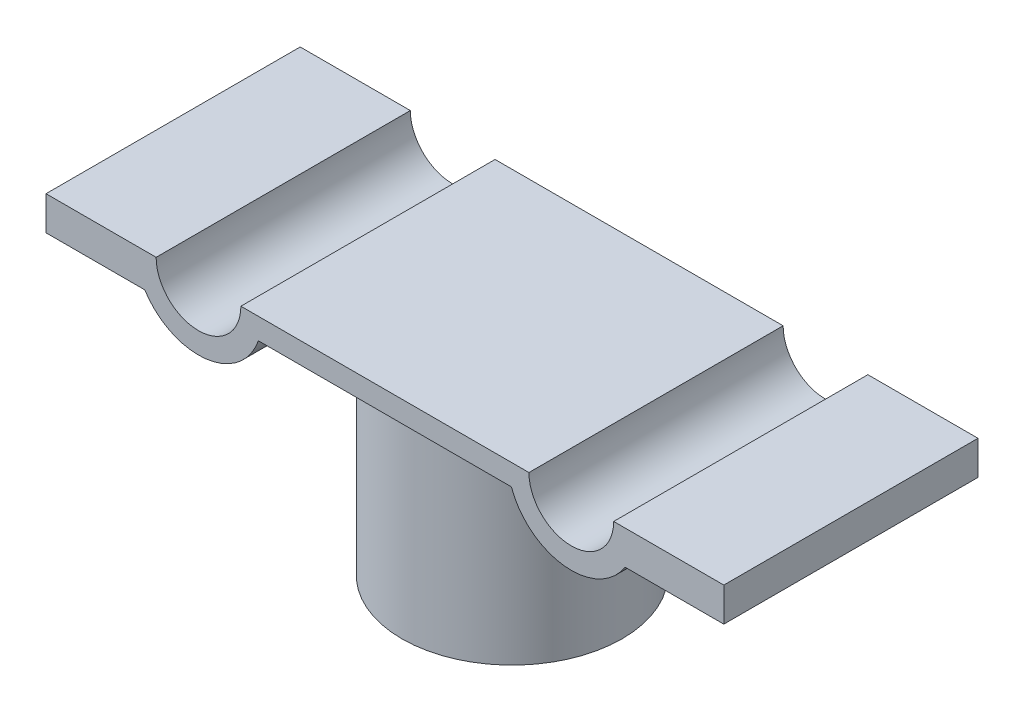
from build123d import *

# Parameters (mm, degrees)
SALIENTE_EXTRUIR1_DEPTH = 30
CROQUIS2_R              = 13
CROQUIS2_R_2            = 10.5
SALIENTE_EXTRUIR2_DEPTH = 20
CROQUIS6_W              = 26
CROQUIS6_H              = 15
CORTAR_EXTRUIR4_DEPTH   = 15
CROQUIS7_R              = 13
SALIENTE_EXTRUIR3_DEPTH = 4
CROQUIS9_R              = 8
CORTAR_EXTRUIR6_DEPTH   = 55.829280499
SALIENTE_EXTRUIR4_START = 4
SALIENTE_EXTRUIR4_DEPTH = 4
CROQUIS8_W              = 8
CROQUIS8_H              = 19
CORTAR_EXTRUIR5_DEPTH   = 20


with BuildPart() as part:
    # Croquis1 → Saliente-Extruir1 (new body)
    with BuildSketch(Plane.XY):
        with BuildLine():
            Line((-40, -1.5), (-40, 2.5))
            Line((-40, 2.5), (-28.34428877, 2.5))
            Line((-28.34428877, 2.5), (-27, 2.5))
            ThreePointArc((-27, 2.5), (-22, -2.5), (-17, 2.5))
            Line((-17, 2.5), (-5.669872981, 2.5))
            Line((-5.669872981, 2.5), (5.669872981, 2.5))
            Line((5.669872981, 2.5), (17, 2.5))
            ThreePointArc((17, 2.5), (22, -2.5), (27, 2.5))
            Line((27, 2.5), (28.34428877, 2.5))
            Line((28.34428877, 2.5), (40, 2.5))
            Line((40, 2.5), (40, -1.5))
            Line((40, -1.5), (28.34428877, -1.5))
            ThreePointArc((28.34428877, -1.5), (21.16660217, -4.953552714), (14.928932188, 0))
            Line((14.928932188, 0), (-14.928932188, 0))
            ThreePointArc((-14.928932188, 0), (-21.16660217, -4.953552714), (-28.34428877, -1.5))
            Line((-28.34428877, -1.5), (-40, -1.5))
        make_face()
    extrude(amount=SALIENTE_EXTRUIR1_DEPTH)

    # Croquis2 → Saliente-Extruir2 (add)
    with BuildSketch(Plane.XZ):
        with Locations(Location((0, 15, 0), (0, 0, 180))):
            Circle(CROQUIS2_R)
        with Locations((0, 15)):
            Circle(CROQUIS2_R_2, mode=Mode.SUBTRACT)
    extrude(amount=SALIENTE_EXTRUIR2_DEPTH)

    # Croquis6 → Cortar-Extruir4 (cut)
    with BuildSketch(Plane.XY):
        with Locations((0, -12.5)):
            Rectangle(CROQUIS6_W, CROQUIS6_H)
    extrude(amount=CORTAR_EXTRUIR4_DEPTH, mode=Mode.SUBTRACT)

    # Croquis7 → Saliente-Extruir3 (add)
    with BuildSketch(Plane.XZ.offset(20)):
        with Locations(Location((0, 15, 0), (0, 0, 180))):
            Circle(CROQUIS7_R)
    extrude(amount=SALIENTE_EXTRUIR3_DEPTH)

    # Croquis9 → Cortar-Extruir6 (cut, through all)
    with BuildSketch(Plane(origin=(0, -20, 0), x_dir=(1, 0, 0), z_dir=(0, 1, 0))):
        with Locations(Location((0, -15, 0), (0, 0, 180))):
            Circle(CROQUIS9_R)
    extrude(amount=-CORTAR_EXTRUIR6_DEPTH, mode=Mode.SUBTRACT)

    # Croquis10 → Saliente-Extruir4 (add)
    with BuildSketch(Plane(origin=(0, -20, 0), x_dir=(1, 0, 0), z_dir=(0, 1, 0)).offset(SALIENTE_EXTRUIR4_START)):
        with BuildLine():
            Line((13, -15), (11, -15))
            ThreePointArc((11, -15), (0, -4), (-11, -15))
            Line((-11, -15), (-13, -15))
            ThreePointArc((-13, -15), (0, -2), (13, -15))
        make_face()
    extrude(amount=-SALIENTE_EXTRUIR4_DEPTH)

    # Croquis8 → Cortar-Extruir5 (cut)
    with BuildSketch(Plane.XY):
        with Locations((0, -14.5)):
            Rectangle(CROQUIS8_W, CROQUIS8_H)
    extrude(amount=CORTAR_EXTRUIR5_DEPTH, mode=Mode.SUBTRACT)


solid = part.part
